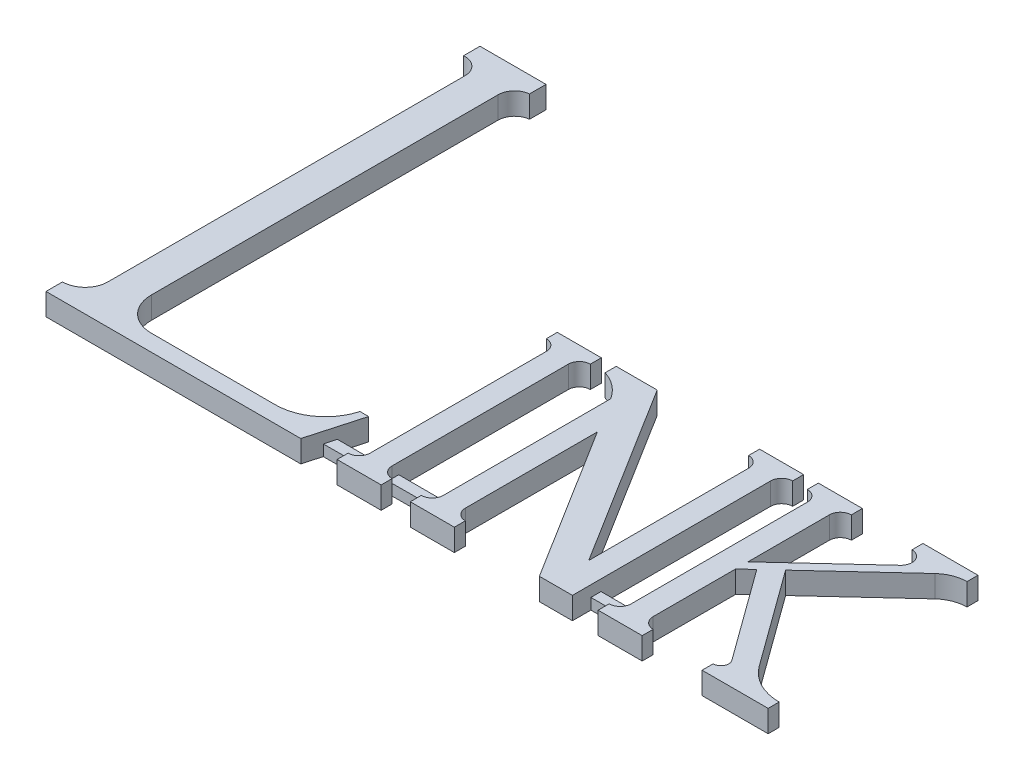
from build123d import *

# Parameters (mm, degrees)
BOSS_EXTRUDE1_DEPTH     = 12.7
BOSS_EXTRUDE1_2_DEPTH   = 12.7
BOSS_EXTRUDE1_3_DEPTH   = 12.7
BOSS_EXTRUDE1_4_DEPTH   = 12.7
BOSS_EXTRUDE2_DEPTH     = 6.35
CUT_EXTRUDE2_DEPTH      = 471.19349296362236
CUT_EXTRUDE2_DEPTH_BACK = 471.19349296362236


with BuildPart() as part:
    # Sketch2 → Boss-Extrude1 (new body)
    with BuildSketch(Plane(origin=(0, 0, 0), x_dir=(1, 0, 0), z_dir=(0, 1, 0))):
        with BuildLine():
            Line((173.83852694696787, 6.353879523850983), (173.83852694696787, 107.95387952385097))
            ThreePointArc((173.83852694696787, 107.95387952385097), (175.69702705818847, 112.4426365219853), (180.18464742311625, 114.30387952385061))
            Line((180.18464742311625, 114.30387952385061), (180.18464742311627, 120.65387952385097))
            Line((180.18464742311627, 120.65387952385097), (154.78464742311627, 120.65387952385103))
            Line((154.78464742311627, 120.65387952385103), (154.78464742311627, 114.30387952385061))
            ThreePointArc((154.78464742311627, 114.30387952385061), (159.27728359825178, 112.44537975999239), (161.1385269469677, 107.95387952385097))
            Line((161.1385269469677, 107.95387952385097), (161.1385269469677, 6.353879523850983))
            ThreePointArc((161.1385269469677, 6.353879523850983), (159.28002683574687, 1.8651225257164699), (154.79240647081883, 0.00387952385118295))
            Line((154.79240647081883, 0.00387952385118295), (154.79240647081883, -6.34612047614902))
            Line((154.79240647081883, -6.34612047614902), (180.19240647081884, -6.34612047614902))
            Line((180.19240647081884, -6.34612047614902), (180.19240647081887, 0.00387952385118295))
            ThreePointArc((180.19240647081887, 0.00387952385118295), (175.69977029568358, 1.8623792877096292), (173.83852694696787, 6.353879523850983))
        make_face()
    extrude(amount=BOSS_EXTRUDE1_DEPTH)



with BuildPart() as body_2:
    # Sketch2 → Boss-Extrude1 2 (new body)
    with BuildSketch(Plane(origin=(0, 0, 0), x_dir=(1, 0, 0), z_dir=(0, 1, 0))):
        with BuildLine():
            Line((290.5044221112303, -6.346119624362247), (290.50442211122953, 107.95388037563158))
            ThreePointArc((290.50442211122953, 107.95388037563158), (292.3629222224477, 112.44263737377035), (296.8505425873776, 114.30388037563806))
            Line((296.8505425873776, 114.30388037563806), (296.8505425873776, 120.65388037564047))
            Line((296.8505425873776, 120.65388037564047), (271.45054258737764, 120.65388037564018))
            Line((271.45054258737764, 120.65388037564018), (271.4505425873777, 114.30388037563777))
            ThreePointArc((271.4505425873777, 114.30388037563777), (275.94317876251387, 112.44538061177975), (277.80442211123, 107.95388037563791))
            Line((277.80442211123, 107.95388037563791), (277.80442211123005, 15.745570535197672))
            Line((277.80442211123005, 15.745570535197672), (212.3933170880388, 120.65388037563798))
            Line((212.3933170880388, 120.65388037563798), (188.7491541871168, 120.65388037563798))
            Line((188.7491541871168, 120.65388037563798), (188.7491541871168, 114.30388037563738))
            ThreePointArc((188.7491541871168, 114.30388037563738), (197.0586174651338, 109.87545758746259), (203.35223987593548, 102.87199949093673))
            Line((203.35223987593548, 102.87199949093673), (203.35223987593548, 6.353880375637708))
            ThreePointArc((203.35223987593548, 6.353880375637708), (201.49271132298225, 1.8640946501521807), (197.00321001616626, 0.00387952385096785))
            Line((197.00321001616626, 0.00387952385096785), (197.00321001616626, -6.34612047614902))
            Line((197.00321001616626, -6.34612047614902), (222.4032100161663, -6.34612058725173))
            Line((222.4032100161663, -6.34612058725173), (222.4027250756679, 0.00387939423115991))
            ThreePointArc((222.4027250756679, 0.00387939423115991), (217.91228324219506, 1.8635802308402507), (216.0522403203464, 6.353880375637722))
            Line((216.0522403203464, 6.353880375637722), (216.0522403203464, 82.50335442487922))
            Line((216.0522403203464, 82.50335442487922), (271.45054277255036, -6.346119624362282))
            Line((271.45054277255036, -6.346119624362282), (290.5044221112303, -6.346119624362247))
        make_face()
    extrude(amount=BOSS_EXTRUDE1_2_DEPTH)


with BuildPart() as body_3:
    # Sketch2 → Boss-Extrude1 3 (new body)
    with BuildSketch(Plane(origin=(0, 0, 0), x_dir=(1, 0, 0), z_dir=(0, 1, 0))):
        with BuildLine():
            ThreePointArc((379.8796721750226, 11.977744632292787), (390.1923529413957, 3.169883174382882), (403.37970421101926, 0.00388024601806133))
            Line((403.37970421101926, 0.00388024601806133), (403.37970421101926, -6.346119753981942))
            Line((403.37970421101926, -6.346119753981942), (365.27970421101924, -6.346119753981938))
            Line((365.27970421101924, -6.346119753981938), (365.2797042110193, 0.00388024601805613))
            ThreePointArc((365.2797042110193, 0.00388024601805613), (369.3036929855622, 2.4697837385241583), (368.9334095604214, 7.174680748774959))
            Line((368.9334095604214, 7.174680748774959), (330.73082744761575, 59.756024084156806))
            Line((330.73082744761575, 59.756024084156806), (324.38179758784645, 53.88870851238104))
            Line((324.38179758784645, 53.88870851238104), (324.38179758784645, 6.353880042329715))
            ThreePointArc((324.38179758784645, 6.353880042329715), (326.24184092866363, 1.8635806636905663), (330.7322823430498, 0.00388024601804399))
            Line((330.7322823430498, 0.00388024601804399), (330.73276728366636, -6.346119735464957))
            Line((330.73276728366636, -6.346119735464957), (305.3327672836663, -6.346119624362247))
            Line((305.3327672836663, -6.346119624362247), (305.3327672836663, 0.00388037563774091))
            ThreePointArc((305.3327672836663, 0.00388037563774091), (309.8222685904823, 1.8640955019389631), (311.6817971434355, 6.3538812274244805))
            Line((311.6817971434355, 6.3538812274244805), (311.6817971434355, 107.95388156073302))
            ThreePointArc((311.6817971434355, 107.95388156073302), (309.82175422158684, 112.44418170553047), (305.331312388114, 114.30388254213955))
            Line((305.331312388114, 114.30388254213955), (305.33082744761555, 120.65388252362244))
            Line((305.33082744761555, 120.65388252362244), (330.7308274476156, 120.65388241251989))
            Line((330.7308274476156, 120.65388241251989), (330.73082744761564, 114.3038824125199))
            ThreePointArc((330.73082744761564, 114.3038824125199), (326.241326559762, 112.4436677052449), (324.38179758784645, 107.95388274582793))
            Line((324.38179758784645, 107.95388274582793), (324.38179758784645, 61.00818587469014))
            Line((324.38179758784645, 61.00818587469014), (370.01136074815463, 103.17573782782141))
            ThreePointArc((370.01136074815463, 103.17573782782141), (371.6316997254356, 110.22586005871784), (365.6567975878465, 114.30388241251993))
            Line((365.6567975878465, 114.30388241251993), (365.6567975878465, 120.65388241251989))
            Line((365.6567975878465, 120.65388241251989), (397.4067975878465, 120.65388241251989))
            Line((397.4067975878465, 120.65388241251989), (397.4067975878465, 114.3038824125199))
            ThreePointArc((397.4067975878465, 114.3038824125199), (390.28312138184594, 112.95972058249937), (384.1390825743689, 109.11208223600183))
            Line((384.1390825743689, 109.11208223600183), (339.36773990380823, 67.7376357737456))
            Line((339.36773990380823, 67.7376357737456), (379.8796721750226, 11.977744632292787))
        make_face()
    extrude(amount=BOSS_EXTRUDE1_3_DEPTH)


with BuildPart() as body_4:
    # Sketch2 → Boss-Extrude1 4 (new body)
    with BuildSketch(Plane(origin=(0, 0, 0), x_dir=(1, 0, 0), z_dir=(0, 1, 0))):
        with BuildLine():
            Line((0, -6.35), (127, -6.35))
            Line((127, -6.35), (133.835466699924, -6.35))
            Line((133.835466699924, -6.35), (142.41022736904142, 24.2201812141727))
            Line((142.41022736904142, 24.2201812141727), (137.42037994397373, 24.2201812141727))
            ThreePointArc((137.42037994397373, 24.2201812141727), (127.07789830370176, 9.03099759553653), (109.65993293339864, 3.1750000000000025))
            Line((109.65993293339864, 3.1750000000000025), (38.100000000000165, 3.1750000000000007))
            ThreePointArc((38.100000000000165, 3.1750000000000007), (24.629615818396296, 8.754615818396267), (19.050000000000022, 22.225000000000133))
            Line((19.050000000000022, 22.225000000000133), (19.049999999999997, 222.25))
            ThreePointArc((19.049999999999997, 222.25), (21.531156391441193, 228.66169963567893), (27.681998366018952, 231.7330466139162))
            Line((27.681998366018952, 231.7330466139162), (27.68199836601896, 241.2580466139162))
            Line((27.68199836601896, 241.2580466139162), (-10.418001633981042, 241.2580466139162))
            Line((-10.418001633981042, 241.2580466139162), (-10.418001633981042, 231.7330466139162))
            ThreePointArc((-10.418001633981042, 231.7330466139162), (-3.1133003643210593, 229.2938436085588), (0, 222.25))
            Line((0, 222.25), (0, 16.260176542443787))
            ThreePointArc((0, 16.260176542443787), (-3.8325594762586483, 7.0075594762586455), (-13.085176542443792, 3.1750000000000007))
            Line((-13.085176542443792, 3.1750000000000007), (-13.085176542443786, -6.35))
            Line((-13.085176542443786, -6.35), (0, -6.35))
        make_face()
    extrude(amount=BOSS_EXTRUDE1_4_DEPTH)


with BuildPart() as part_1:
    add(part.part)

    add(body_2.part)  # Boss-Extrude2 merges body 2

    add(body_3.part)  # Boss-Extrude2 merges body 3

    add(body_4.part)  # Boss-Extrude2 merges body 4
    # Sketch4 → Boss-Extrude2 (add)
    with BuildSketch(Plane(origin=(0, 0, 0), x_dir=(1, 0, 0), z_dir=(0, 1, 0))):
        Polygon((136.68158195989426, 3.7967857367812146), (376.38878950850017, 4.555259431461488), (376.38878950850017, 10.146785736781245), (136.68158195989426, 10.146785736781215), align=None)
    extrude(amount=BOSS_EXTRUDE2_DEPTH)

    # Sketch6 → Cut-Extrude2 (cut, two sides: drawn at the far end of the back side and taken through both)
    with BuildSketch(Plane(origin=(0, 12.7, 0), x_dir=(1, 0, 0), z_dir=(0, 1, 0)).offset(-CUT_EXTRUDE2_DEPTH_BACK)):
        with BuildLine():
            Line((324.6925686344705, 4.391683942646109), (369.79590978466945, 4.534398457384592))
            ThreePointArc((369.79590978466945, 4.534398457384592), (369.57267914306925, 5.922493261126043), (368.9334095604214, 7.174680748774945))
            Line((368.9334095604214, 7.174680748774945), (366.77404888893807, 10.146785736781244))
            Line((366.77404888893807, 10.146785736781244), (324.38179758784645, 10.146785736781238))
            Line((324.38179758784645, 10.146785736781238), (324.38179758784645, 6.353880042329715))
            ThreePointArc((324.38179758784645, 6.353880042329715), (324.4599715437991, 5.360553286293043), (324.6925686344705, 4.391683942646109))
        make_face()
        with BuildLine():
            Line((216.4851967942631, 4.049297720927505), (264.8734590646552, 4.202406275479168))
            Line((264.8734590646552, 4.202406275479168), (261.16709462286485, 10.14678573678123))
            Line((261.16709462286485, 10.14678573678123), (216.0522403203464, 10.146785736781224))
            Line((216.0522403203464, 10.146785736781224), (216.0522403203464, 6.353880375637722))
            ThreePointArc((216.0522403203464, 6.353880375637722), (216.16141789373137, 5.181430727271779), (216.4851967942631, 4.049297720927505))
        make_face()
    extrude(amount=CUT_EXTRUDE2_DEPTH + CUT_EXTRUDE2_DEPTH_BACK, mode=Mode.SUBTRACT)


solid = part_1.part
